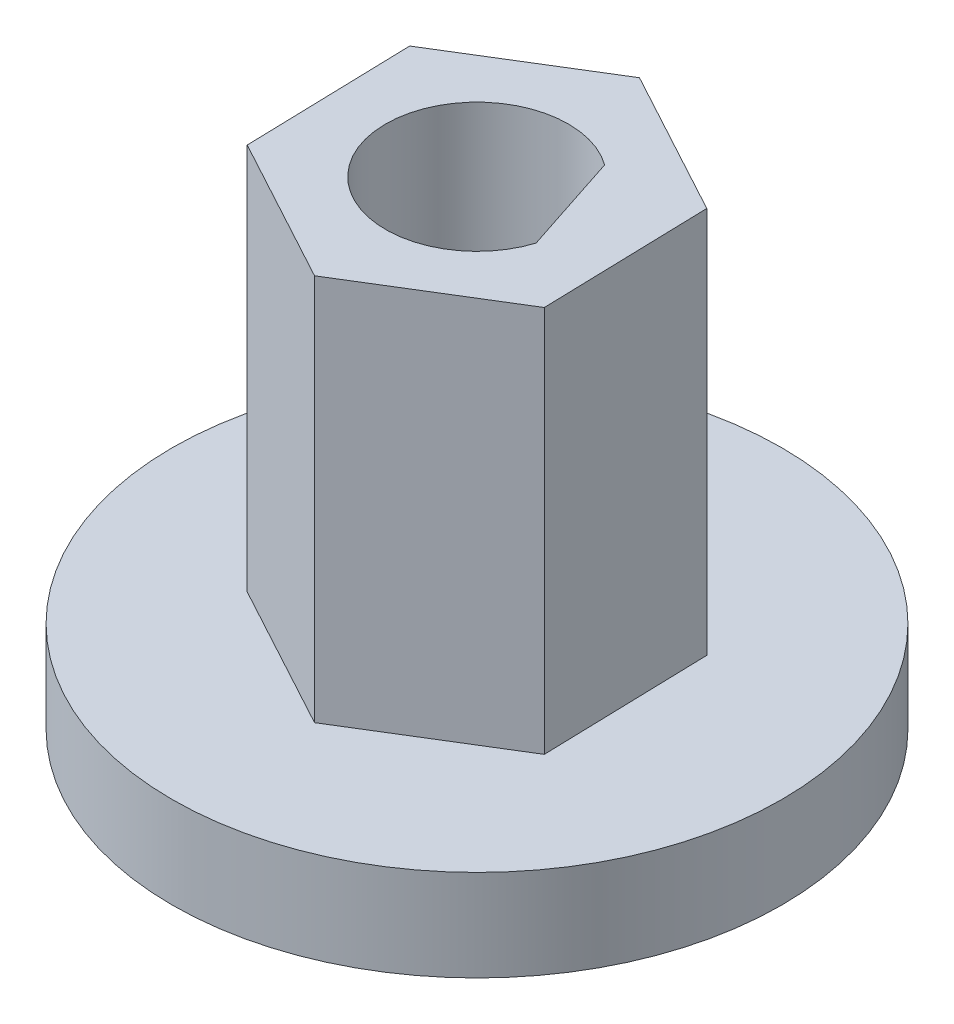
from build123d import *

# Parameters (mm, degrees)
SKETCH1_R           = 10
BOSS_EXTRUDE1_DEPTH = 3
BOSS_EXTRUDE2_DEPTH = 12.7
CUT_EXTRUDE1_DEPTH  = 23


with BuildPart() as part:
    # Sketch1 → Boss-Extrude1 (new body)
    with BuildSketch(Plane(origin=(0, 0, 0), x_dir=(1, 0, 0), z_dir=(0, 1, 0))):
        with Locations(Location((0, 0, 0), (0, 0, 270))):
            Circle(SKETCH1_R)
    extrude(amount=BOSS_EXTRUDE1_DEPTH)

    # Sketch2 → Boss-Extrude2 (add)
    with BuildSketch(Plane(origin=(0, 3, 0), x_dir=(1, 0, 0), z_dir=(0, 1, 0))):
        Polygon((0.148889151, -5.48), (4.820263788, -2.611058213), (4.671374637, 2.868941787), (-0.148889151, 5.48), (-4.820263788, 2.611058213), (-4.671374637, -2.868941787), align=None)
    extrude(amount=BOSS_EXTRUDE2_DEPTH)

    # Sketch6 → Cut-Extrude1 (cut)
    with BuildSketch(Plane(origin=(0, 15.7, 0), x_dir=(1, 0, 0), z_dir=(0, 1, 0))):
        with BuildLine():
            Line((2.855757074, -0.919049257), (1.757975678, 2.430950743))
            ThreePointArc((1.757975678, 2.430950743), (-2.850834523, -0.934206895), (2.855757074, -0.919049257))
        make_face()
    extrude(amount=-CUT_EXTRUDE1_DEPTH, mode=Mode.SUBTRACT)


solid = part.part
